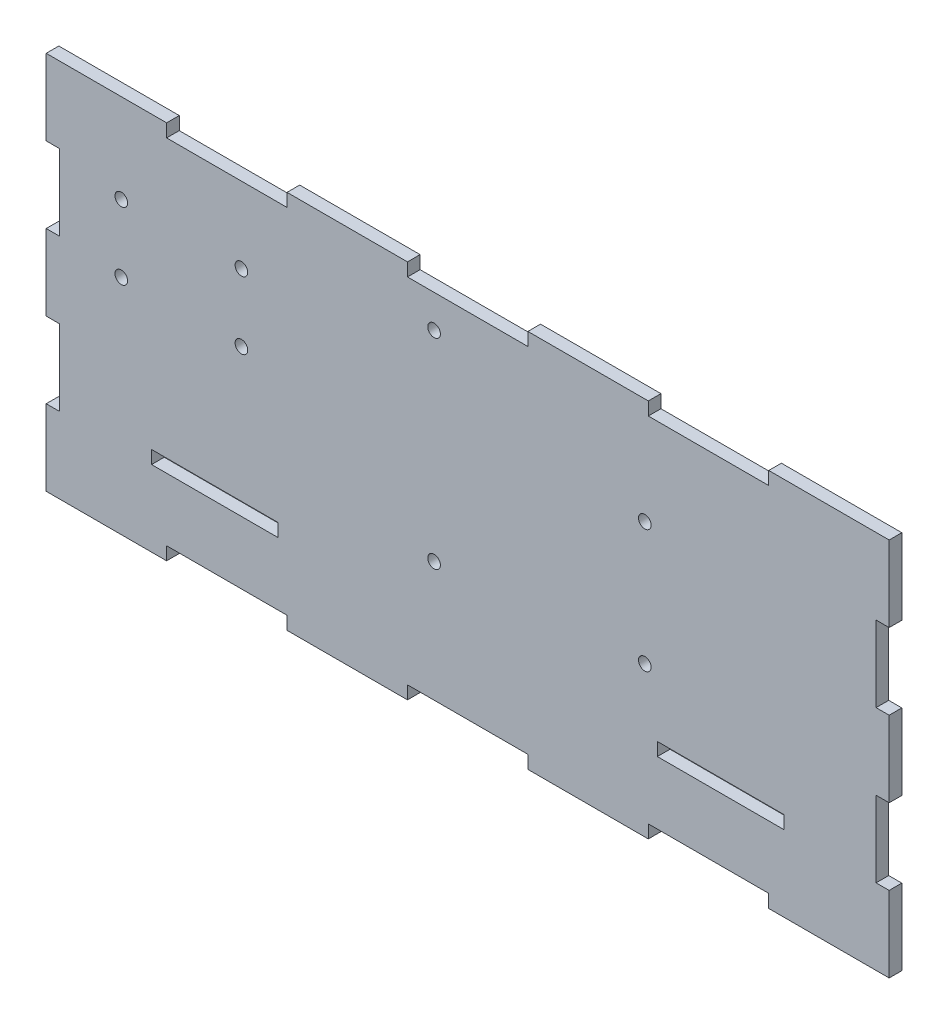
from build123d import *

# Parameters (mm, degrees)
SALIENTE_EXTRUIR1_DEPTH = 1.5
CROQUIS2_W              = 30
CROQUIS2_H              = 3.1
CORTAR_EXTRUIR1_DEPTH   = 10
CROQUIS3_R              = 1.5
CORTAR_EXTRUIR2_DEPTH   = 3
CROQUIS6_R              = 1.5
CORTAR_EXTRUIR3_DEPTH   = 3
CROQUIS8_R              = 1.5
CORTAR_EXTRUIR4_DEPTH   = 3


with BuildPart() as part:
    # Croquis1 → Saliente-Extruir1 (new, symmetric)
    with BuildSketch(Plane.XY):
        Polygon((-100, -27), (-100, -45), (-71.428571429, -45), (-71.428571429, -41.9), (-42.857142857, -41.9), (-42.857142857, -45), (-14.285714286, -45), (-14.285714286, -41.9), (14.285714286, -41.9), (14.285714286, -45), (42.857142857, -45), (42.857142857, -41.9), (71.428571429, -41.9), (71.428571429, -45), (100, -45), (100, -27), (96.9, -27), (96.9, -9), (100, -9), (100, 9), (96.9, 9), (96.9, 27), (100, 27), (100, 45), (71.428571429, 45), (71.428571429, 41.9), (42.857142857, 41.9), (42.857142857, 45), (14.285714286, 45), (14.285714286, 41.9), (-14.285714286, 41.9), (-14.285714286, 45), (-42.857142857, 45), (-42.857142857, 41.9), (-71.428571429, 41.9), (-71.428571429, 45), (-100, 45), (-100, 27), (-96.9, 27), (-96.9, 9), (-100, 9), (-100, -9), (-96.9, -9), (-96.9, -27), align=None)
    extrude(amount=SALIENTE_EXTRUIR1_DEPTH, both=True)

    # Croquis2 → Cortar-Extruir1 (cut)
    with BuildSketch(Plane.XY.offset(1.5)):
        with Locations((-60, -25.45)):
            Rectangle(CROQUIS2_W, CROQUIS2_H)
        with Locations((60, -25.45)):
            Rectangle(CROQUIS2_W, CROQUIS2_H)
    extrude(amount=-CORTAR_EXTRUIR1_DEPTH, mode=Mode.SUBTRACT)

    # Croquis3 → Cortar-Extruir2 (cut)
    with BuildSketch(Plane.XY.offset(1.5)):
        with Locations((-82.180986704, 23.889608573)):
            Circle(CROQUIS3_R)
        with Locations((-53.680986704, 23.889608573)):
            Circle(CROQUIS3_R)
        with Locations((-53.680986704, 7.889608573)):
            Circle(CROQUIS3_R)
        with Locations((-82.180986704, 7.889608573)):
            Circle(CROQUIS3_R)
    extrude(amount=-CORTAR_EXTRUIR2_DEPTH, mode=Mode.SUBTRACT)

    # Croquis6 → Cortar-Extruir3 (cut)
    with BuildSketch(Plane.XY.offset(1.5)):
        with Locations((-7.971882846, 34.085861189)):
            Circle(CROQUIS6_R)
        with Locations((-7.971882846, -13.414138811)):
            Circle(CROQUIS6_R)
    extrude(amount=-CORTAR_EXTRUIR3_DEPTH, mode=Mode.SUBTRACT)

    # Croquis8 → Cortar-Extruir4 (cut)
    with BuildSketch(Plane.XY.offset(1.5)):
        with Locations((42.028117154, 19.785861189)):
            Circle(CROQUIS8_R)
        with Locations((42.028117154, -9.414138811)):
            Circle(CROQUIS8_R)
    extrude(amount=-CORTAR_EXTRUIR4_DEPTH, mode=Mode.SUBTRACT)


solid = part.part
